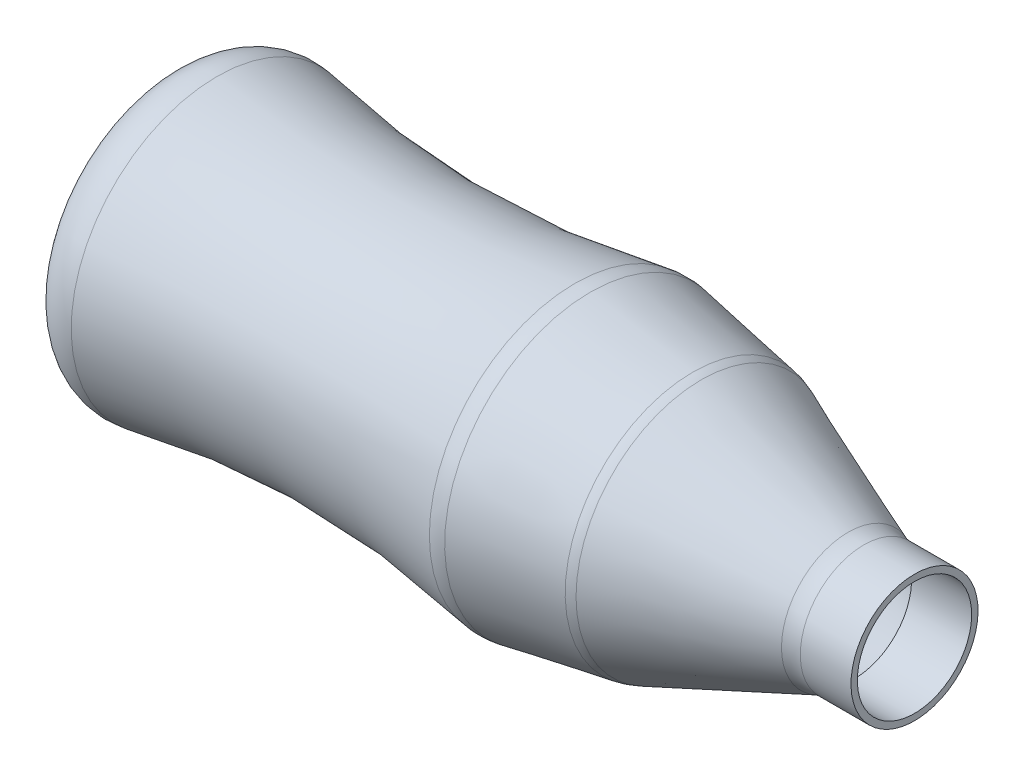
from build123d import *

# Parameters (mm, degrees)
FILLET1_R = 10


with BuildPart() as part:
    # Sketch1 → Revolve1 (revolve)
    with BuildSketch(Plane.XY):
        with BuildLine():
            ThreePointArc((1.5, 24.57), (4.516916983, 31.065059709), (11.426070736, 32.949518021))
            ThreePointArc((11.426070736, 32.949518021), (54.755418646, 28.809847984), (98.05771623, 33.223495257))
            Line((98.05771623, 33.223495257), (124.713836064, 28.549572437))
            Line((124.713836064, 28.549572437), (162.227403624, 13.5))
            Line((162.227403624, 13.5), (174.917066057, 13.5))
            Line((174.917066057, 13.5), (176.417066057, 13.5))
            Line((176.417066057, 13.5), (176.417066057, 15))
            Line((176.417066057, 15), (162.517066057, 15))
            Line((162.517066057, 15), (125.127066057, 30))
            Line((125.127066057, 30), (98.037066057, 34.75))
            ThreePointArc((98.037066057, 34.75), (54.883168803, 30.3102994), (11.697066057, 34.424946311))
            ThreePointArc((11.697066057, 34.424946311), (3.556812147, 32.217570221), (0, 24.57))
            Line((0, 24.57), (0, 0))
            Line((0, 0), (1.5, 0))
            Line((1.5, 0), (1.5, 24.57))
        make_face()
    revolve(axis=Axis((174.917066057, 0, 0), (-1, 0, 0)))

    # Fillet1
    fillet1_edges = [part.edges().sort_by_distance(p)[0] for p in [
        (98.037066057, -34.75, 0),
        (125.127066057, -30, 0),
        (162.517066057, -15, 0),
    ]]
    fillet(fillet1_edges, radius=FILLET1_R)


solid = part.part
